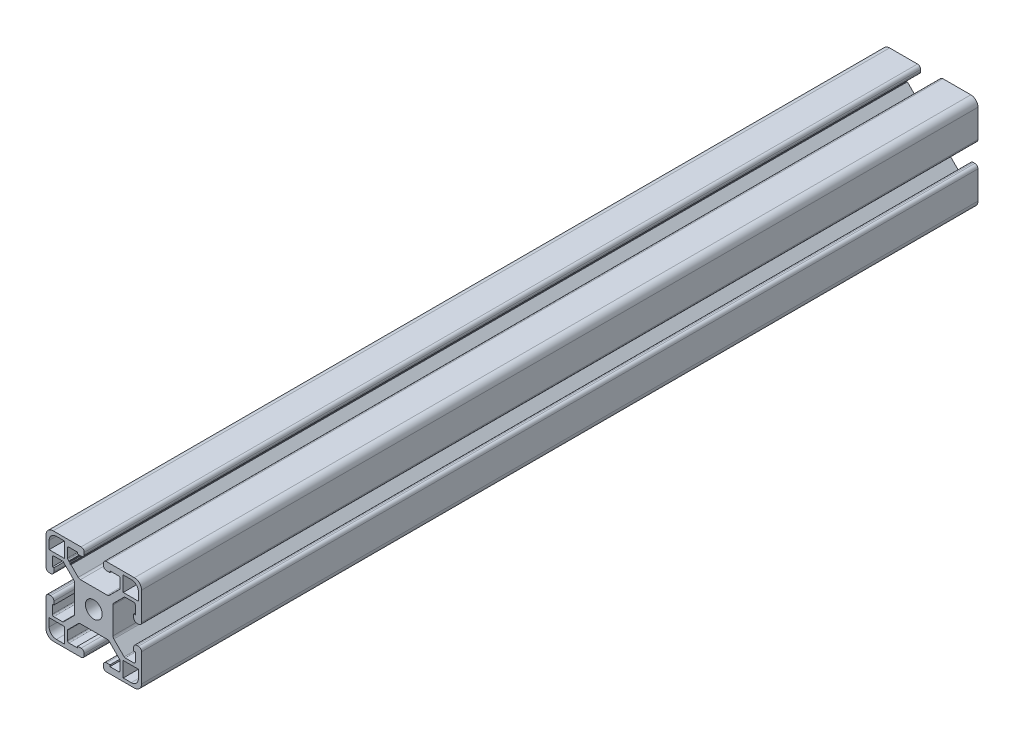
from build123d import *

# Parameters (mm, degrees)
BOSS_EXTRUDE1_DEPTH     = 175
CUT_EXTRUDE1_DEPTH      = 178.270979012
CUT_EXTRUDE1_DEPTH_BACK = 178.270979012


with BuildPart() as part:
    # Sketch4 → Boss-Extrude1 (new, symmetric)
    with BuildSketch(Plane.XY):
        with BuildLine():
            Line((20, -17), (20, -5.32))
            ThreePointArc((20, -5.32), (19.613380951, -4.386619049), (18.68, -4))
            Line((18.68, -4), (18.02, -4))
            ThreePointArc((18.02, -4), (17.086619049, -4.386619049), (16.7, -5.32))
            Line((16.7, -5.32), (16.7, -6.75))
            Line((16.7, -6.75), (17.36, -6.75))
            Line((17.36, -6.75), (17.36, -10.4))
            ThreePointArc((17.36, -10.4), (17.184264069, -10.824264069), (16.76, -11))
            Line((16.76, -11), (13.11529004, -11))
            ThreePointArc((13.11529004, -11), (12.88567998, -10.95432772), (12.691025971, -10.824264069))
            Line((12.691025971, -10.824264069), (8.386619049, -6.519857147))
            ThreePointArc((8.386619049, -6.519857147), (8.100479017, -6.091618326), (8, -5.586476195))
            Line((8, -5.586476195), (8, 0))
            Line((8, 0), (3.5, 0))
            ThreePointArc((3.5, 0), (2.474873734, -2.474873734), (0, -3.5))
            Line((0, -3.5), (0, -8))
            Line((0, -8), (5.586476195, -8))
            ThreePointArc((5.586476195, -8), (6.091618326, -8.100479017), (6.519857147, -8.386619049))
            Line((6.519857147, -8.386619049), (10.824264069, -12.691025971))
            ThreePointArc((10.824264069, -12.691025971), (10.95432772, -12.88567998), (11, -13.11529004))
            Line((11, -13.11529004), (11, -16.76))
            ThreePointArc((11, -16.76), (10.824264069, -17.184264069), (10.4, -17.36))
            Line((10.4, -17.36), (6.75, -17.36))
            Line((6.75, -17.36), (6.75, -16.7))
            Line((6.75, -16.7), (5.32, -16.7))
            ThreePointArc((5.32, -16.7), (4.386619049, -17.086619049), (4, -18.02))
            Line((4, -18.02), (4, -18.68))
            ThreePointArc((4, -18.68), (4.386619049, -19.613380951), (5.32, -20))
            Line((5.32, -20), (17, -20))
            ThreePointArc((17, -20), (19.121320344, -19.121320344), (20, -17))
        make_face()
        with BuildLine():
            Line((15.68, -18.68), (12.32, -18.68))
            Line((12.32, -18.68), (12.32, -12.32))
            Line((12.32, -12.32), (18.68, -12.32))
            Line((18.68, -12.32), (18.68, -15.68))
            ThreePointArc((18.68, -15.68), (17.801320344, -17.801320344), (15.68, -18.68))
        make_face(mode=Mode.SUBTRACT)
    extrude(amount=BOSS_EXTRUDE1_DEPTH, both=True)

    # Mirror1: part across plane


with BuildPart() as part_1:
    add(part.part)
    add(part.part.mirror(Plane(origin=(0, 0, 0), x_dir=(0, 0, 1), z_dir=(1, 0, 0))))

    # Mirror2: part across plane


with BuildPart() as part_2:
    add(part_1.part)
    add(part_1.part.mirror(Plane.ZX))

    # Sketch5 → Cut-Extrude1 (cut, two sides: drawn at the far end of the back side and taken through both)
    with BuildSketch(Plane.XY.offset(-CUT_EXTRUDE1_DEPTH_BACK)):
        Polygon((-10.453238098, 12.32), (-10.453238098, 11.99), (-10.123238098, 11.99), (-9.88989286, 11.756654762), (-9.88989286, 11.426654762), (-9.55989286, 11.426654762), (-9.55989286, 12.32), align=None)
    extrude(amount=CUT_EXTRUDE1_DEPTH + CUT_EXTRUDE1_DEPTH_BACK, mode=Mode.SUBTRACT)


solid = part_2.part
